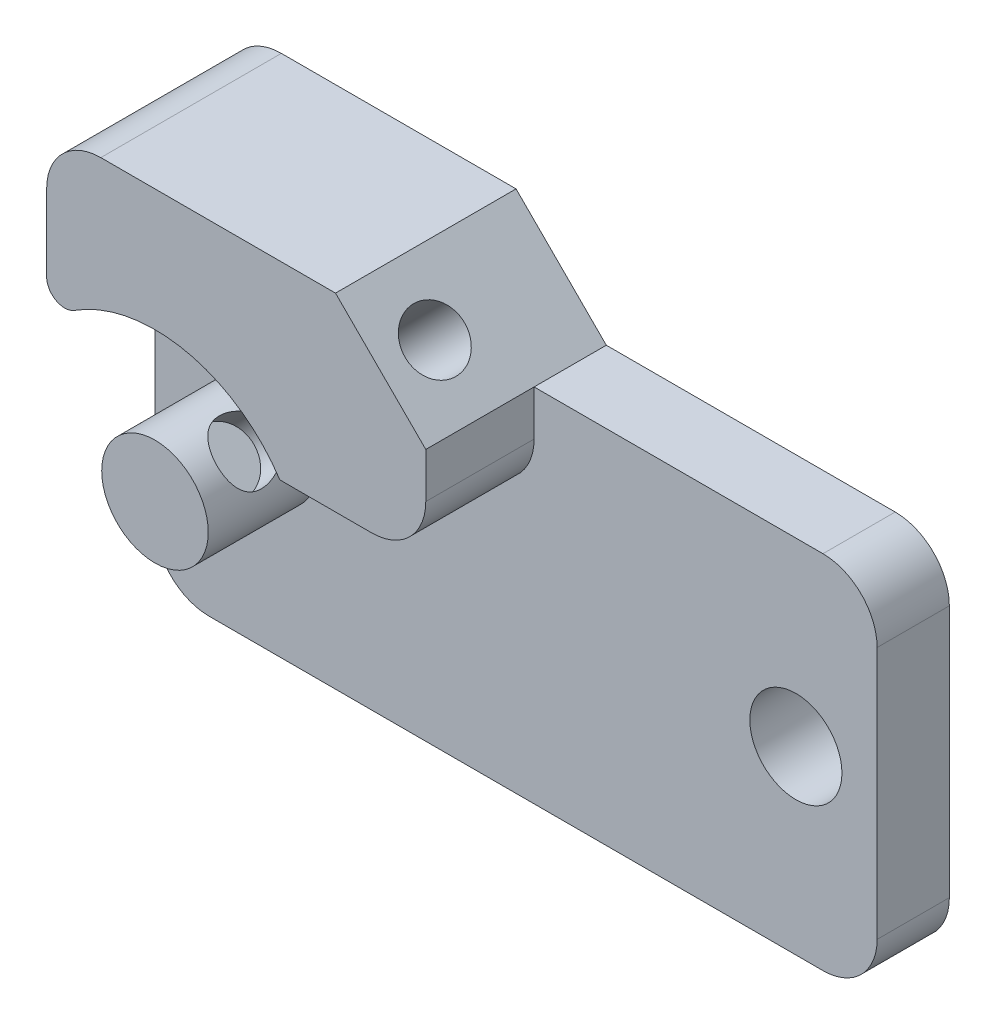
from build123d import *

# Parameters (mm, degrees)
ESQUISSE1_W                  = 40
ESQUISSE1_H                  = 20
BOSS_EXTRU_1_DEPTH           = 4
ESQUISSE2_R                  = 2.95
BOSS_EXTRU_2_DEPTH           = 6
ENL_V_MAT_EXTRU_1_DEPTH      = 46.122056691
ENL_V_MAT_EXTRU_1_DEPTH_BACK = 46.122056691
ESQUISSE3_R                  = 2.55
ESQUISSE4_W                  = 21
ESQUISSE4_H                  = 5
BOSS_EXTRU_4_DEPTH           = 4
ESQUISSE5_W                  = 21
ESQUISSE5_H                  = 10.5
BOSS_EXTRU_5_DEPTH           = 6
ENL_V_START                  = -6
ESQUISSE6_R                  = 8.25
ESQUISSE6_R_2                = 2.95
ENL_V_MAT_EXTRU_2_DEPTH      = 6
CHANFREIN1_SIZE              = 5
ESQUISSE7_R                  = 1.65
ENL_V_MAT_EXTRU_3_DEPTH      = 16.5
CONG_1_R                     = 3
CONG_2_R                     = 1


with BuildPart() as part:
    # Esquisse1 → Boss.-Extru.1 (new body)
    with BuildSketch(Plane.XY):
        with Locations((20, 10)):
            Rectangle(ESQUISSE1_W, ESQUISSE1_H)
    extrude(amount=BOSS_EXTRU_1_DEPTH)

    # Esquisse2 → Boss.-Extru.2 (add)
    with BuildSketch(Plane.XY.offset(4)):
        with Locations(Location((6, 10, 0), (0, 0, 180))):
            Circle(ESQUISSE2_R)
    extrude(amount=BOSS_EXTRU_2_DEPTH)

    # Esquisse3 → Enlèv. mat.-Extru.1 (cut, two sides: drawn at the far end of the back side and taken through both)
    with BuildSketch(Plane.XY.offset(4).offset(-ENL_V_MAT_EXTRU_1_DEPTH_BACK)):
        with Locations((35.5, 10)):
            Circle(ESQUISSE3_R)
    extrude(amount=ENL_V_MAT_EXTRU_1_DEPTH + ENL_V_MAT_EXTRU_1_DEPTH_BACK, mode=Mode.SUBTRACT)

    # Esquisse4 → Boss.-Extru.4 (add)
    with BuildSketch(Plane.XY.offset(4)):
        with Locations((10.5, 22.5)):
            Rectangle(ESQUISSE4_W, ESQUISSE4_H)
    extrude(amount=-BOSS_EXTRU_4_DEPTH)

    # Esquisse5 → Boss.-Extru.5 (add)
    with BuildSketch(Plane.XY.offset(4)):
        with Locations((10.5, 19.75)):
            Rectangle(ESQUISSE5_W, ESQUISSE5_H)
    extrude(amount=BOSS_EXTRU_5_DEPTH)

    # Esquisse6 → Enlèv. mat.-Extru.2 (cut)
    with BuildSketch(Plane.XY.offset(10).offset(ENL_V_START)):
        with Locations((6, 10)):
            Circle(ESQUISSE6_R)
        with Locations(Location((6, 10, 0), (0, 0, 180))):
            Circle(ESQUISSE6_R_2, mode=Mode.SUBTRACT)
    extrude(amount=ENL_V_MAT_EXTRU_2_DEPTH, mode=Mode.SUBTRACT)

    # Chanfrein1
    chanfrein1_edges = [part.edges().sort_by_distance(p)[0] for p in [
        (21, 25, 5),
    ]]
    chamfer(chanfrein1_edges, length=CHANFREIN1_SIZE)

    # Esquisse7 → Enlèv. mat.-Extru.3 (cut)
    with BuildSketch(Plane(origin=(20.5, 20.5, 0), x_dir=(0, 0, -1), z_dir=(0.7071067811865471, 0.707106781186548, 0))):
        with Locations(Location((-7, 2.828427125, 0), (0, 0, 90))):
            Circle(ESQUISSE7_R)
    extrude(amount=-ENL_V_MAT_EXTRU_3_DEPTH, mode=Mode.SUBTRACT)

    # Congé1
    cong_1_edges = [part.edges().sort_by_distance(p)[0] for p in [
        (0, 25, 5),
        (21, 14.5, 7),
        (40, 20, 2),
        (40, 0, 2),
        (0, 0, 2),
    ]]
    fillet(cong_1_edges, radius=CONG_1_R)

    # Congé2
    cong_2_edges = [part.edges().sort_by_distance(p)[0] for p in [
        (0, 15.662375826, 7),
    ]]
    fillet(cong_2_edges, radius=CONG_2_R)


solid = part.part
